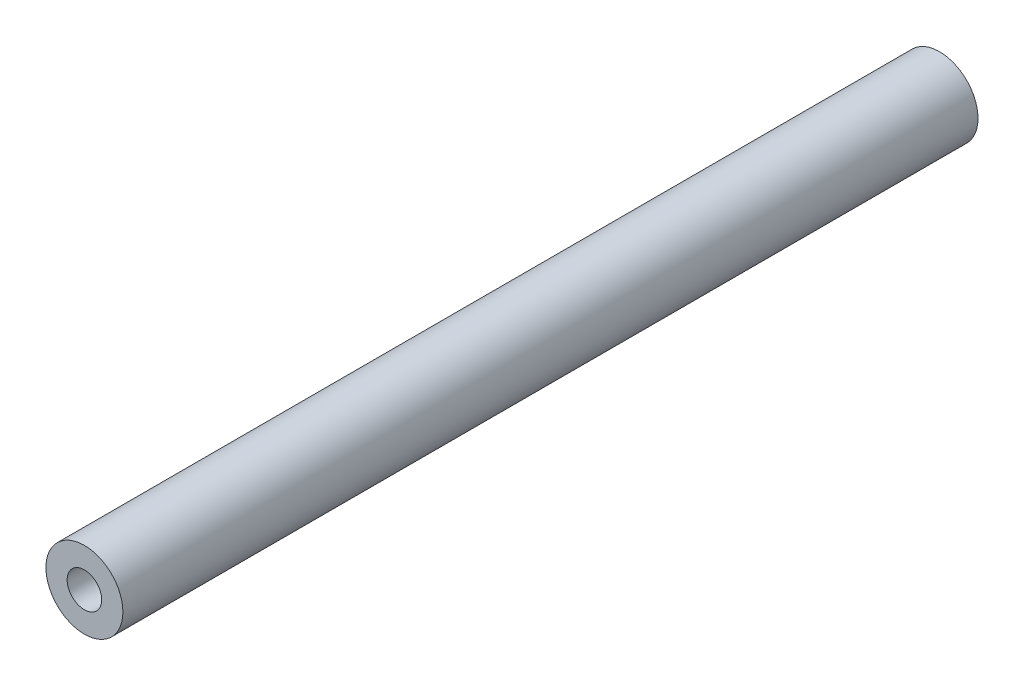
from build123d import *

# Parameters (mm, degrees)
SKETCH_EXPANSION_COLUMN_R   = 4.5
EXPANSION_COLUMN_DEPTH      = 100
M4_THREAD_ENVELOPE_START    = -1
SKETCH_M4_THREAD_ENVELOPE_R = 2.02
M4_THREAD_ENVELOPE_DEPTH    = 102


with BuildPart() as part:
    # Sketch_Expansion_column → Expansion_column (new body)
    with BuildSketch(Plane.XY):
        Circle(SKETCH_EXPANSION_COLUMN_R)
    extrude(amount=EXPANSION_COLUMN_DEPTH)

    # Sketch_M4_thread_envelope → M4_thread_envelope (cut)
    with BuildSketch(Plane.XY.offset(M4_THREAD_ENVELOPE_START)):
        Circle(SKETCH_M4_THREAD_ENVELOPE_R)
    extrude(amount=M4_THREAD_ENVELOPE_DEPTH, mode=Mode.SUBTRACT)


solid = part.part
